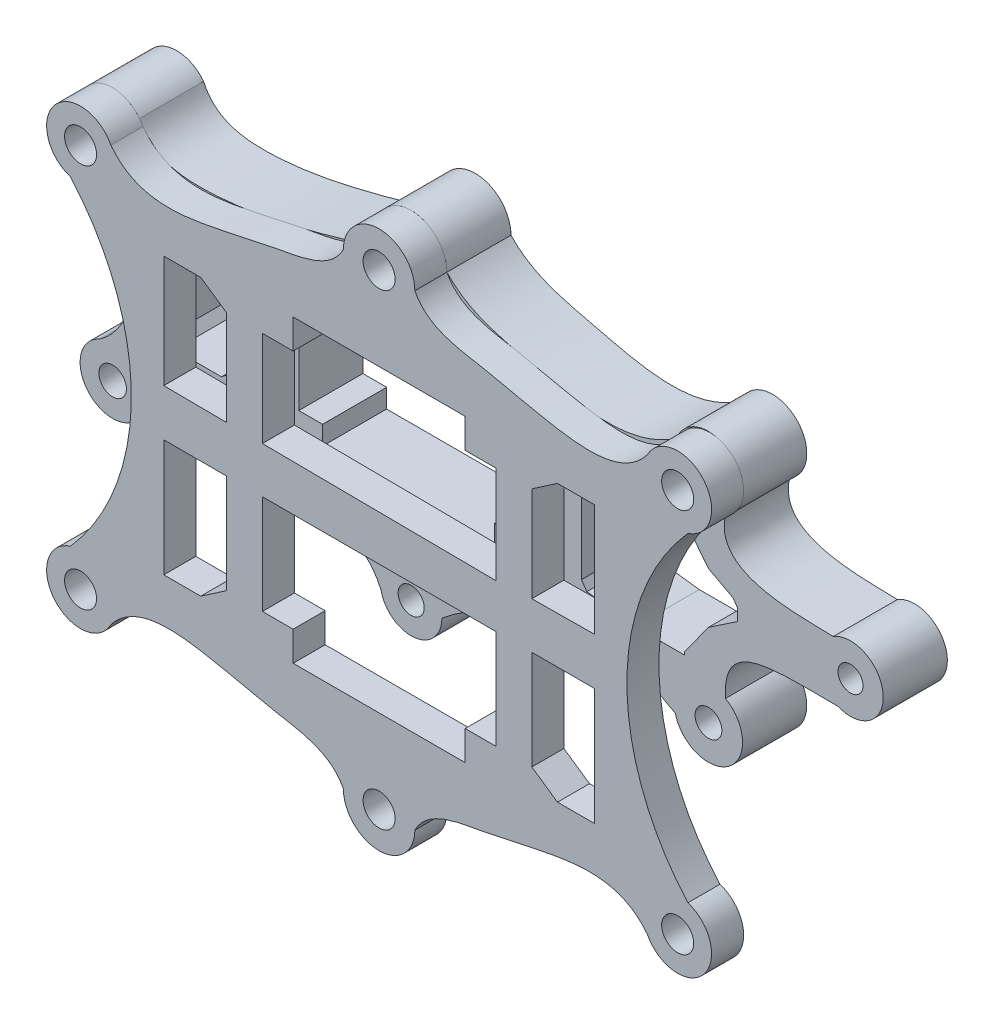
from build123d import *

# Parameters (mm, degrees)
SKETCH1_R           = 4.308101429
SKETCH1_R_2         = 4.070534956
SKETCH1_R_3         = 4.188733122
SKETCH1_R_4         = 3.909525581
SKETCH1_R_5         = 3.856072912
SKETCH1_R_6         = 4.058364248
SKETCH1_R_7         = 3.943086
BOSS_EXTRUDE1_DEPTH = 20
SCALE1_SCALE        = 0.5
SKETCH3_R           = 2.5
BOSS_EXTRUDE2_DEPTH = 5


with BuildPart() as part:
    # Sketch1 → Boss-Extrude1 (new body)
    with BuildSketch(Plane.XY):
        with BuildLine():
            add(Edge.make_bspline(
                [(76.543737018, 205.208376265), (80.771266636, 199.274895566), (96.865850274, 197.688855126), (117.349852584, 201.318105517), (134.043030338, 205.484311396), (147.579425269, 209.515429562), (148.686418237, 214.186485586)],
                knots=[0.033398545, 0.033398545, 0.033398545, 0.033398545, 0.290886662, 0.576208547, 0.791203768, 0.976782801, 0.976782801, 0.976782801, 0.976782801], degree=3))
            add(Edge.make_bspline(
                [(75.078792443, 207.788015047), (75.504362003, 206.834798383), (75.995388063, 205.978002556), (76.543737018, 205.208376265)],
                knots=[0, 0, 0, 0, 0.033398545, 0.033398545, 0.033398545, 0.033398545], degree=3))
            ThreePointArc((75.078792443, 207.788015047), (58.016465577, 207.387518143), (63.501024585, 191.225741993))
            add(Edge.make_bspline(
                [(62.683878743, 141.974777384), (67.012798773, 144.981493657), (76.082428486, 159.391104607), (74.312978576, 176.738960763), (63.501024585, 191.225741993)],
                knots=[0, 0, 0, 0, 0.274530858, 1, 1, 1, 1], degree=3))
            ThreePointArc((62.683878743, 141.974777384), (59.39827219, 125.625640603), (75.855078431, 128.32063823))
            add(Edge.make_bspline(
                [(76.338088045, 129.536305853), (76.098540347, 129.181303146), (75.927135179, 128.781944867), (75.855078431, 128.32063823)],
                knots=[0.983991691, 0.983991691, 0.983991691, 0.983991691, 1, 1, 1, 1], degree=3))
            add(Edge.make_bspline(
                [(150.437749559, 118.060859695), (145.224531207, 129.960502912), (125.667208177, 130.446552796), (101.34841848, 139.111275477), (84.620872045, 135.684213171), (76.829923596, 130.265191805), (76.338088045, 129.536305853)],
                knots=[0, 0, 0, 0, 0.405688573, 0.655311626, 0.951123685, 0.983991691, 0.983991691, 0.983991691, 0.983991691], degree=3))
            ThreePointArc((150.437749559, 118.060859695), (160.785276573, 110.41088633), (169.422288635, 119.950038831))
            add(Edge.make_bspline(
                [(242.2350523, 130.665535521), (236.243546919, 134.307651451), (213.232451782, 140.471357972), (184.954990641, 132.743203556), (169.422288635, 119.950038831)],
                knots=[0, 0, 0, 0, 0.262007325, 1, 1, 1, 1], degree=3))
            ThreePointArc((242.2350523, 130.665535521), (259.000679516, 124.720543619), (257.909970741, 142.475529933))
            add(Edge.make_bspline(
                [(293.012518869, 157.889873478), (288.205800462, 157.811553926), (270.867281219, 158.743534183), (257.091416568, 154.486464669), (257.909970741, 142.475529933)],
                knots=[0, 0, 0, 0, 0.44257558, 1, 1, 1, 1], degree=3))
            ThreePointArc((293.012518869, 157.889873478), (307.087741631, 168.167048524), (291.537881464, 176.036868822))
            add(Edge.make_bspline(
                [(257.909970741, 192.06592491), (253.850716783, 174.862797409), (281.583389113, 176.477202162), (291.537881464, 176.036868822)],
                knots=[0, 0, 0, 0, 1, 1, 1, 1], degree=3))
            ThreePointArc((257.909970741, 192.06592491), (259.528564649, 209.432463461), (242.618703085, 205.157760035))
            add(Edge.make_bspline(
                [(170.98562499, 214.186485586), (177.545121184, 207.167357912), (202.451333932, 201.746684198), (227.251177201, 194.577672651), (242.618703085, 205.157760035)],
                knots=[0, 0, 0, 0, 0.360083142, 1, 1, 1, 1], degree=3))
            ThreePointArc((170.98562499, 214.186485586), (160.784257019, 225.295693706), (148.847706554, 216.076085442))
            add(Edge.make_bspline(
                [(148.686418237, 214.186485586), (148.824910586, 214.770866462), (148.882574653, 215.399127062), (148.847706554, 216.076085442)],
                knots=[0.976782801, 0.976782801, 0.976782801, 0.976782801, 1, 1, 1, 1], degree=3))
        make_face()
        with Locations((66.694725579, 132.66402241)):
            Circle(SKETCH1_R, mode=Mode.SUBTRACT)
        with Locations((159.836021613, 119.950038831)):
            Circle(SKETCH1_R_2, mode=Mode.SUBTRACT)
        Polygon((83.858166214, 184.878066453), (86.002510663, 184.878066453), (100.638701035, 184.878066453), (107.481595235, 179.935976198), (107.481595235, 156.175926893), (100.638701035, 150.758635651), (86.002510663, 150.758635651), (83.858166214, 153.467281272), (83.858166214, 157.72182523), (83.858166214, 179.935976198), (83.858166214, 182.407021325), align=None, mode=Mode.SUBTRACT)
        Polygon((132.192046512, 182.216940931), (132.192046512, 187.539191975), (185.794717744, 187.539191975), (185.794717744, 182.216940931), (193.017772733, 182.216940931), (193.017772733, 153.704881765), (185.794717744, 153.704881765), (185.794717744, 147.812389537), (132.192046512, 147.812389537), (132.192046512, 153.704881765), (124.778911129, 153.704881765), (124.778911129, 182.216940931), align=None, mode=Mode.SUBTRACT)
        with Locations((252.583843732, 133.237345071)):
            Circle(SKETCH1_R_3, mode=Mode.SUBTRACT)
        with Locations((296.902462307, 167.339385675)):
            Circle(SKETCH1_R_4, mode=Mode.SUBTRACT)
        with Locations((66.694725579, 201.321027186)):
            Circle(SKETCH1_R_5, mode=Mode.SUBTRACT)
        with Locations((159.836021613, 214.186485586)):
            Circle(SKETCH1_R_6, mode=Mode.SUBTRACT)
        Polygon((214.656925005, 149.709313702), (212.976214149, 152.112958462), (212.976214149, 182.216940931), (216.337635861, 184.878066453), (223.240555449, 184.878066453), (237.116424243, 187.539191975), (242.618703085, 188.594423534), (246.81052436, 188.066807755), (246.81052436, 182.216940931), (252.583843732, 174.924326987), (260.306232365, 170.812117265), (261.636795126, 168.828900714), (261.636795126, 165.109705431), (252.583843732, 159.035976368), (248.733608741, 153.704881765), (245.052007945, 148.607280663), (245.052007945, 147.812389537), (239.867563664, 147.812389537), (229.727677965, 147.812389537), (223.240555449, 148.628910085), align=None, mode=Mode.SUBTRACT)
        with Locations((252.583843732, 201.321027186)):
            Circle(SKETCH1_R_7, mode=Mode.SUBTRACT)
    extrude(amount=BOSS_EXTRUDE1_DEPTH)


with BuildPart() as part_1:
    # Scale1: scaled about (0, 0, 0)
    add(part.part.scale(SCALE1_SCALE))


with BuildPart() as body_2:
    # Sketch3 → Boss-Extrude2 (new body)
    with BuildSketch(Plane.XY.offset(10)):
        with BuildLine():
            add(Edge.make_bspline(
                [(121.761228468, 38.277232342), (117.899041819, 43.28523295), (107.648212445, 42.04517464), (95.58517999, 39.021597361), (87.480638881, 38.036126746), (85.492812495, 34.227784393)],
                knots=[0, 0, 0, 0, 0.434829884, 0.696530761, 1, 1, 1, 1], degree=3))
            ThreePointArc((121.761228468, 38.277232342), (130.520381765, 37.229211009), (128.085509321, 45.70815619))
            ThreePointArc((128.085509321, 45.70815619), (118.56848974, 70.660513593), (128.085509321, 95.612870996))
            ThreePointArc((128.085509321, 95.612870996), (130.520381765, 104.091816177), (121.761228468, 103.043794844))
            add(Edge.make_bspline(
                [(121.761228468, 103.043794844), (117.899041819, 98.035794237), (107.648212445, 99.275852547), (95.58517999, 102.299429825), (87.480638881, 103.284900441), (85.492812495, 107.093242793)],
                knots=[0, 0, 0, 0, 0.434829884, 0.696530761, 1, 1, 1, 1], degree=3))
            ThreePointArc((85.492812495, 107.093242793), (79.918010807, 112.668044481), (74.343209119, 107.093242793))
            add(Edge.make_bspline(
                [(38.074793146, 103.043794844), (41.936979794, 98.035794237), (52.187809168, 99.275852547), (64.250841624, 102.299429825), (72.355382732, 103.284900441), (74.343209119, 107.093242793)],
                knots=[0, 0, 0, 0, 0.434829884, 0.696530761, 1, 1, 1, 1], degree=3))
            ThreePointArc((38.074793146, 103.043794844), (29.315639848, 104.091816177), (31.750512293, 95.612870996))
            ThreePointArc((31.750512293, 95.612870996), (41.267531873, 70.660513593), (31.750512293, 45.70815619))
            ThreePointArc((31.750512293, 45.70815619), (29.315639848, 37.229211009), (38.074793146, 38.277232342))
            add(Edge.make_bspline(
                [(38.074793146, 38.277232342), (41.936979794, 43.28523295), (52.187809168, 42.04517464), (64.250841624, 39.021597361), (72.355382732, 38.036126746), (74.343209119, 34.227784393)],
                knots=[0, 0, 0, 0, 0.434829884, 0.696530761, 1, 1, 1, 1], degree=3))
            ThreePointArc((74.343209119, 34.227784393), (79.918010807, 28.652982705), (85.492812495, 34.227784393))
        make_face()
        with Locations((33.347362789, 40.660513593)):
            Circle(SKETCH3_R, mode=Mode.SUBTRACT)
        Polygon((56.098797877, 67.370758764), (56.098797877, 51.871663354), (52.09237434, 49.129599177), (46.330931894, 49.129599177), (46.330931894, 67.370758764), align=None, mode=Mode.SUBTRACT)
        with Locations((79.918010807, 34.227784393)):
            Circle(SKETCH3_R, mode=Mode.SUBTRACT)
        with Locations((126.488658824, 40.660513593)):
            Circle(SKETCH3_R, mode=Mode.SUBTRACT)
        Polygon((93.332236436, 47.268674701), (66.503785178, 47.268674701), (66.503785178, 51.871663354), (61.70900533, 51.871663354), (61.70900533, 67.370758764), (98.127016283, 67.370758764), (98.127016283, 51.871663354), (93.332236436, 51.871663354), align=None, mode=Mode.SUBTRACT)
        Polygon((103.737223736, 51.871663354), (103.737223736, 67.370758764), (113.505089719, 67.370758764), (113.505089719, 49.129599177), (107.743647273, 49.129599177), align=None, mode=Mode.SUBTRACT)
        Polygon((56.098797877, 89.449363832), (56.098797877, 74.605314673), (46.330931894, 74.688737907), (46.330931894, 92.19142801), (52.09237434, 92.19142801), align=None, mode=Mode.SUBTRACT)
        with Locations((33.347362789, 100.660513593)):
            Circle(SKETCH3_R, mode=Mode.SUBTRACT)
        Polygon((66.503785178, 94.052352486), (93.332236436, 94.052352486), (93.332236436, 89.449363832), (98.127016283, 89.449363832), (98.127016283, 74.246369341), (61.70900533, 74.557400252), (61.70900533, 89.449363832), (66.503785178, 89.449363832), align=None, mode=Mode.SUBTRACT)
        Polygon((113.505089719, 92.19142801), (113.505089719, 74.688737907), (103.737223736, 74.605314673), (103.737223736, 89.449363832), (107.743647273, 92.19142801), align=None, mode=Mode.SUBTRACT)
        with Locations((79.918010807, 107.093242793)):
            Circle(SKETCH3_R, mode=Mode.SUBTRACT)
        with Locations((126.488658824, 100.660513593)):
            Circle(SKETCH3_R, mode=Mode.SUBTRACT)
    extrude(amount=BOSS_EXTRUDE2_DEPTH)


solid = Compound([part_1.part, body_2.part])
